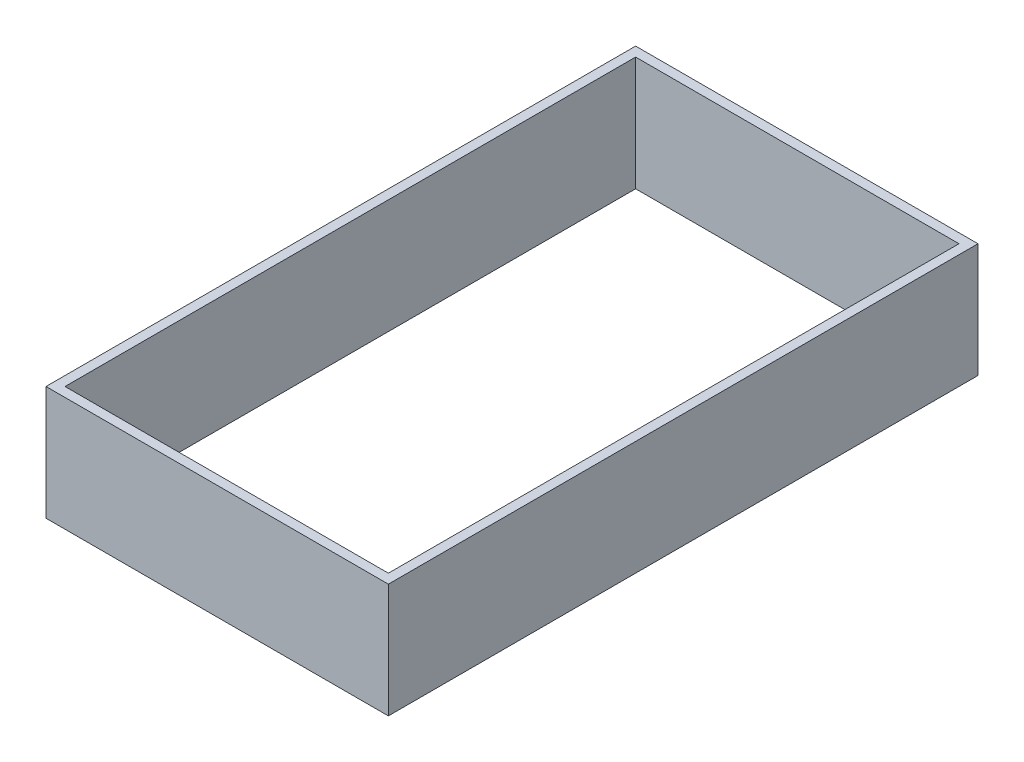
from build123d import *

# Parameters (mm, degrees)
SKETCH1_W           = 18000
SKETCH1_H           = 31000
SKETCH1_W_2         = 17000
SKETCH1_H_2         = 30000
BOSS_EXTRUDE2_DEPTH = 6000


with BuildPart() as part:
    # Sketch1 → Boss-Extrude2 (new body)
    with BuildSketch(Plane(origin=(0, 0, 0), x_dir=(1, 0, 0), z_dir=(0, 1, 0))):
        Rectangle(SKETCH1_W, SKETCH1_H)
        Rectangle(SKETCH1_W_2, SKETCH1_H_2, mode=Mode.SUBTRACT)
    extrude(amount=BOSS_EXTRUDE2_DEPTH)


solid = part.part
